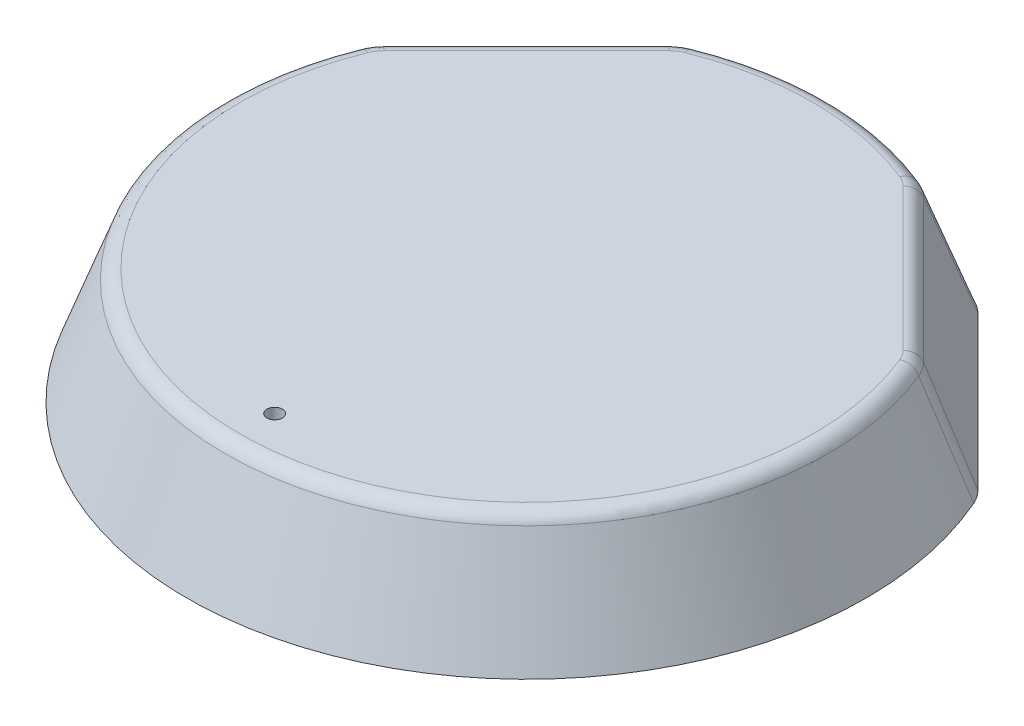
from build123d import *

# Parameters (mm, degrees)
EXTRUDE_1_DEPTH     = 15
DRAFT_2_ANGLE       = -20
FILLET_1_R          = 6
FILLET_2_R          = 2
CUT_EXTRUDE_START   = 6
SKETCH_2_R          = 1
CUT_EXTRUDE_1_DEPTH = 59.007812184


with BuildPart() as part:
    # 草图1 → 凸台-拉伸1 (new body)
    with BuildSketch(Plane(origin=(0, 0, 0), x_dir=(1, 0, 0), z_dir=(0, 1, 0))):
        with BuildLine():
            Line((-18.595203517, 39.87754263), (-39.87754263, 18.595203517))
            ThreePointArc((-39.87754263, 18.595203517), (0, -44), (39.87754263, 18.595203517))
            Line((39.87754263, 18.595203517), (18.595203517, 39.87754263))
            ThreePointArc((18.595203517, 39.87754263), (0, 44), (-18.595203517, 39.87754263))
        make_face()
    extrude(amount=EXTRUDE_1_DEPTH)

    # 拔模2
    draft_2_faces = [part.faces().sort_by_distance(p)[0] for p in [
        (29.236373073, 7.5, -29.236373073),
        (0, 7.5, 44),
        (-29.236373073, 7.5, -29.236373073),
        (0, 7.5, -44),
    ]]
    draft(draft_2_faces, Plane(origin=(0, 0, 0), x_dir=(0, 0, -1), z_dir=(0, -1, 0)), DRAFT_2_ANGLE)

    # 圆角1
    fillet_1_edges = [part.edges().sort_by_distance(p)[0] for p in [
        (17.010833705, 7.500497123, -37.601169244),
        (37.601169244, 7.500497123, -17.010833705),
        (-37.601169244, 7.500497123, -17.010833705),
        (-17.010833705, 7.500497123, -37.601169244),
    ]]
    fillet(fillet_1_edges, radius=FILLET_1_R)

    # 圆角2
    fillet_2_edges = [part.edges().sort_by_distance(p)[0] for p in [
        (-35.248872303, 15, -15.340682868),
        (-25.375885761, 15, -25.375885761),
        (-15.340682868, 15, -35.248872303),
        (0, 15, -38.540446486),
        (15.340682868, 15, -35.248872303),
        (25.375885761, 15, -25.375885761),
        (35.248872303, 15, -15.340682868),
        (0, 15, 38.540446486),
    ]]
    fillet(fillet_2_edges, radius=FILLET_2_R)

    # 草图2 → 切除-拉伸1 (cut, through all)
    with BuildSketch(Plane(origin=(0, 0, 0), x_dir=(1, 0, 0), z_dir=(0, 1, 0)).offset(CUT_EXTRUDE_START)):
        with Locations(Location((0, -32.614789591, 0), (0, 0, 270))):
            Circle(SKETCH_2_R)
    extrude(amount=CUT_EXTRUDE_1_DEPTH, mode=Mode.SUBTRACT)


solid = part.part
